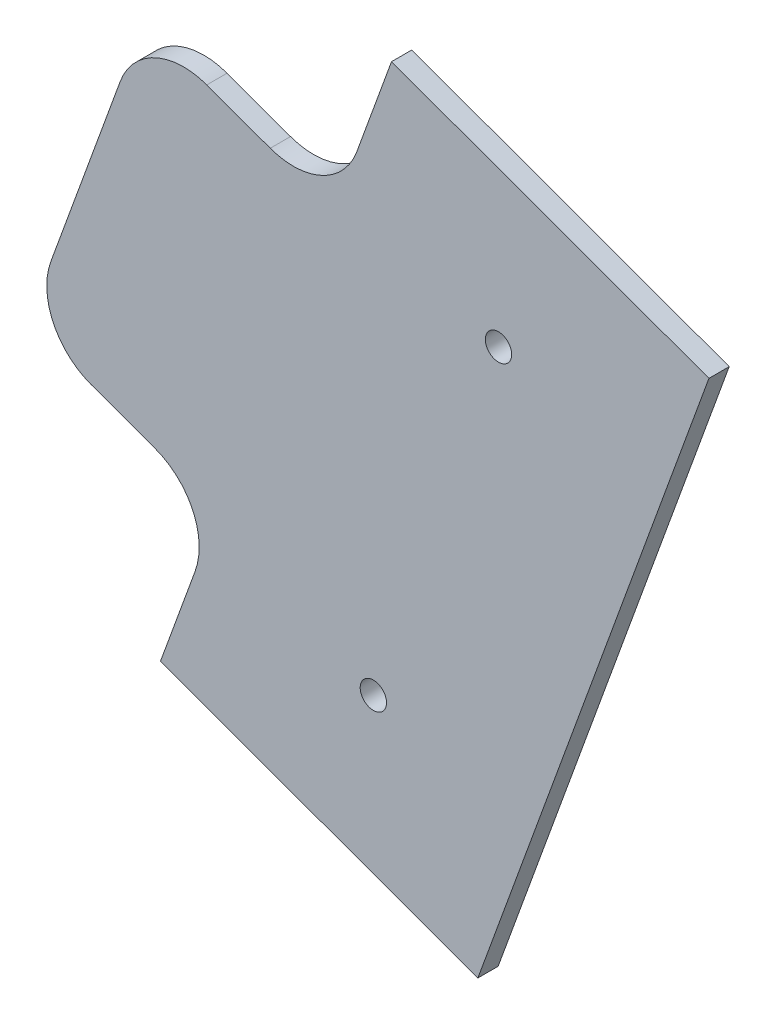
from build123d import *

# Parameters (mm, degrees)
EXTRUDE_1_DEPTH     = 3
CUT_EXTRUDE_1_REACH = 877.393
SKETCH_2_R          = 1.95
EXTRUDE_2_DEPTH     = 3
FILLET_1_R          = 10


with BuildPart() as part:
    # 草图1 → 凸台-拉伸1 (new body)
    with BuildSketch(Plane.XY):
        Polygon((366.808331571, 667.065590198), (401.010345904, 761.034852277), (354.025714865, 778.135859443), (319.823700532, 684.166597365), align=None)
    extrude(amount=EXTRUDE_1_DEPTH)

    # 草图2 → 切除-拉伸1 (cut, up to next)
    with BuildSketch(Plane.XY.offset(3), mode=Mode.PRIVATE) as cut_extrude_1_sk1:
        with Locations((351.338243096, 695.576064033)):
            Circle(SKETCH_2_R)
    cut_extrude_1_tool1 = extrude(cut_extrude_1_sk1.sketch, amount=-CUT_EXTRUDE_1_REACH, mode=Mode.PRIVATE) & part.part
    # 草图2 → 切除-拉伸1 (cut, up to next)
    with BuildSketch(Plane.XY.offset(3), mode=Mode.PRIVATE) as cut_extrude_1_sk2:
        with Locations((369.862047426, 749.482173827)):
            Circle(SKETCH_2_R)
    cut_extrude_1_tool2 = extrude(cut_extrude_1_sk2.sketch, amount=-CUT_EXTRUDE_1_REACH, mode=Mode.PRIVATE) & part.part
    add(cut_extrude_1_tool1.solids().sort_by_distance((351.338243, 695.576064, 3))[0], mode=Mode.SUBTRACT)
    add(cut_extrude_1_tool2.solids().sort_by_distance((369.862047, 749.482174, 3))[0], mode=Mode.SUBTRACT)

    # 草图3 → 凸台-拉伸2 (add)
    with BuildSketch(Plane.XY.offset(3)):
        Polygon((345.475211281, 754.643543924), (317.284432658, 764.904148223), (300.183425492, 717.919517184), (328.374204115, 707.658912884), align=None)
    extrude(amount=-EXTRUDE_2_DEPTH)

    # 圆角1
    fillet_1_edges = [part.edges().sort_by_distance(p)[0] for p in [
        (345.475211281, 754.643543924, 1.5),
        (328.374204115, 707.658912884, 1.5),
        (300.183425492, 717.919517184, 1.5),
        (317.284432658, 764.904148223, 1.5),
    ]]
    fillet(fillet_1_edges, radius=FILLET_1_R)


solid = part.part
